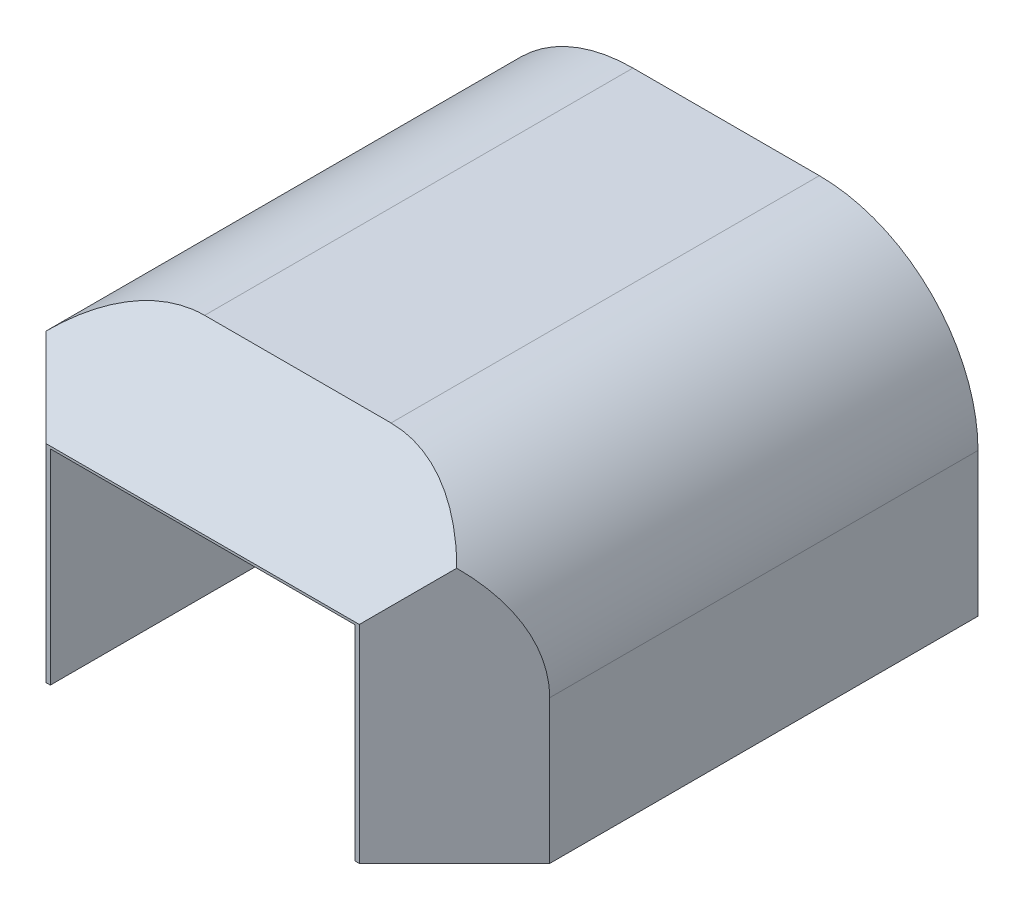
from build123d import *

# Parameters (mm, degrees)
BOSS_EXTRUDE1_DEPTH = 16.5
CHAMFER1_SIZE       = 6
FILLET1_R           = 10


with BuildPart() as part:
    # Sketch1 → Boss-Extrude1 (new, symmetric)
    with BuildSketch(Plane.XY):
        Polygon((15.875, 0), (9.6, 0), (9.6, 12.9), (-9.6, 12.9), (-9.6, 0), (-15.875, 0), (-15.875, 19.05), (15.875, 19.05), align=None)
    extrude(amount=BOSS_EXTRUDE1_DEPTH, both=True)

    # Chamfer1
    chamfer1_edges = [part.edges().sort_by_distance(p)[0] for p in [
        (15.875, 9.525, 16.5),
        (0, 19.05, 16.5),
        (-15.875, 9.525, 16.5),
    ]]
    chamfer(chamfer1_edges, length=CHAMFER1_SIZE)

    # Fillet1
    fillet1_edges = [part.edges().sort_by_distance(p)[0] for p in [
        (-15.875, 19.05, -3),
        (15.875, 19.05, -3),
    ]]
    fillet(fillet1_edges, radius=FILLET1_R)


solid = part.part
